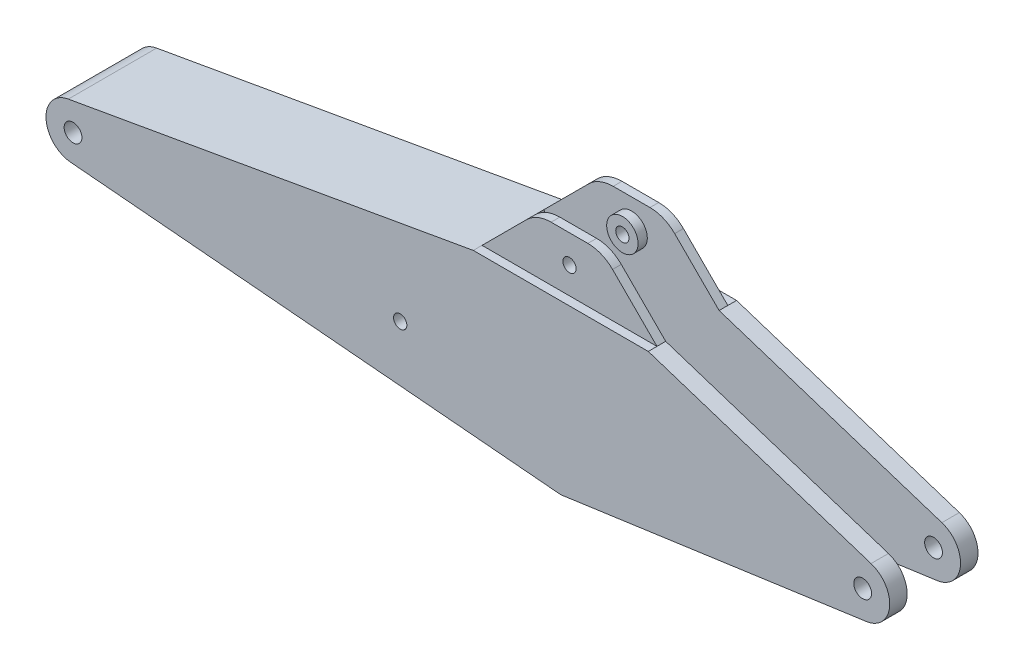
from build123d import *
from build123d.topology import SkipClean

# Parameters (mm, degrees)
SKETCH1_R           = 51
SKETCH1_R_2         = 38
BOSS_EXTRUDE2_DEPTH = 253
CUT_EXTRUDE1_DEPTH  = 153
SKETCH3_W           = 1002.596871638
SKETCH3_H           = 474.869981991
CUT_EXTRUDE3_DEPTH  = 50
SKETCH4_R           = 90
SKETCH4_R_2         = 38
BOSS_EXTRUDE3_DEPTH = 53


with BuildPart() as part:
    # Sketch1 → Boss-Extrude2 (new, symmetric)
    with BuildSketch(Plane.XY):
        with BuildLine():
            Line((-4551.922095967, 152.644032798), (-2231.298435819, 561.936500623))
            Line((-2231.298435819, 561.936500623), (-1976.813580205, 816.421356237))
            ThreePointArc((-1976.813580205, 816.421356237), (-1911.92891044, 859.775906502), (-1835.392223967, 875))
            Line((-1835.392223967, 875), (-1624.607776033, 875))
            ThreePointArc((-1624.607776033, 875), (-1548.07108956, 859.775906502), (-1483.186419795, 816.421356237))
            Line((-1483.186419795, 816.421356237), (-1228.701564181, 561.936500623))
            Line((-1228.701564181, 561.936500623), (47.869484486, 147.422903428))
            ThreePointArc((47.869484486, 147.422903428), (154.41275497, -13.479655139), (21.601139584, -153.487428699))
            Line((21.601139584, -153.487428699), (-1730, -400))
            Line((-1730, -400), (-4538.502435017, -154.410764679))
            ThreePointArc((-4538.502435017, -154.410764679), (-4679.85218061, -6.767729338), (-4551.922095967, 152.644032798))
        make_face()
        Circle(SKETCH1_R, mode=Mode.SUBTRACT)
        with Locations((-2650, 0)):
            Circle(SKETCH1_R_2, mode=Mode.SUBTRACT)
        with Locations((-4525, 0)):
            Circle(SKETCH1_R, mode=Mode.SUBTRACT)
        with Locations((-1730, 714.936500623)):
            Circle(SKETCH1_R_2, mode=Mode.SUBTRACT)
    extrude(amount=BOSS_EXTRUDE2_DEPTH, both=True)

    # Sketch2 → Cut-Extrude1 (cut, symmetric)
    with BuildSketch(Plane.XY):
        with BuildLine():
            Line((-2224.35079815, 522.544492159), (-2231.298435819, 561.936500623))
            Line((-2231.298435819, 561.936500623), (-2231.298435819, 1101.816027208))
            Line((-2231.298435819, 1101.816027208), (280.40791441, 1101.816027208))
            Line((280.40791441, 1101.816027208), (280.40791441, -255.886784207))
            Line((280.40791441, -255.886784207), (-706, -255.886784207))
            Line((-706, -255.886784207), (-711.574487634, -216.277125188))
            Line((-711.574487634, -216.277125188), (-1731.058577343, -359.754791807))
            Line((-1731.058577343, -359.754791807), (-4535.017935657, -114.562825407))
            ThreePointArc((-4535.017935657, -114.562825407), (-4639.890327549, -5.021218541), (-4544.974458298, 113.252024334))
            Line((-4544.974458298, 113.252024334), (-2224.35079815, 522.544492159))
        make_face()
    extrude(amount=CUT_EXTRUDE1_DEPTH, both=True, mode=Mode.SUBTRACT)

    # Sketch3 → Cut-Extrude3 (cut)
    with BuildSketch(Plane.XY.offset(253)):
        with Locations((-1730, 799.371491619)):
            Rectangle(SKETCH3_W, SKETCH3_H)
    cut_extrude3 = extrude(amount=-CUT_EXTRUDE3_DEPTH, mode=Mode.SUBTRACT)

    # Mirror2: Cut-Extrude3 across plane
    add(cut_extrude3.mirror(Plane.XY), mode=Mode.SUBTRACT)

    # Sketch4 → Boss-Extrude3 (add)
    # profile 1 of 2: a face of its own
    with BuildSketch(Plane.XY.offset(-153)):
        with Locations((-1730, 714.936500623)):
            Circle(SKETCH4_R)
        with Locations(Location((-1730, 714.936500623, 0), (0, 0, 180))):
            Circle(SKETCH4_R_2, mode=Mode.SUBTRACT)
    # profile 2 of 2: a face of its own
    with BuildSketch(Plane.XY.offset(-153)):
        with Locations((-2650, 0)):
            Circle(SKETCH4_R)
        with Locations((-2650, 0)):
            Circle(SKETCH4_R_2, mode=Mode.SUBTRACT)
    boss_extrude3 = extrude(amount=BOSS_EXTRUDE3_DEPTH)

    # Mirror3: Boss-Extrude3 across plane
    with SkipClean():  # the faces are left unmerged after this step: merging them gives an invalid solid
        add(boss_extrude3.mirror(Plane.XY))


solid = part.part
